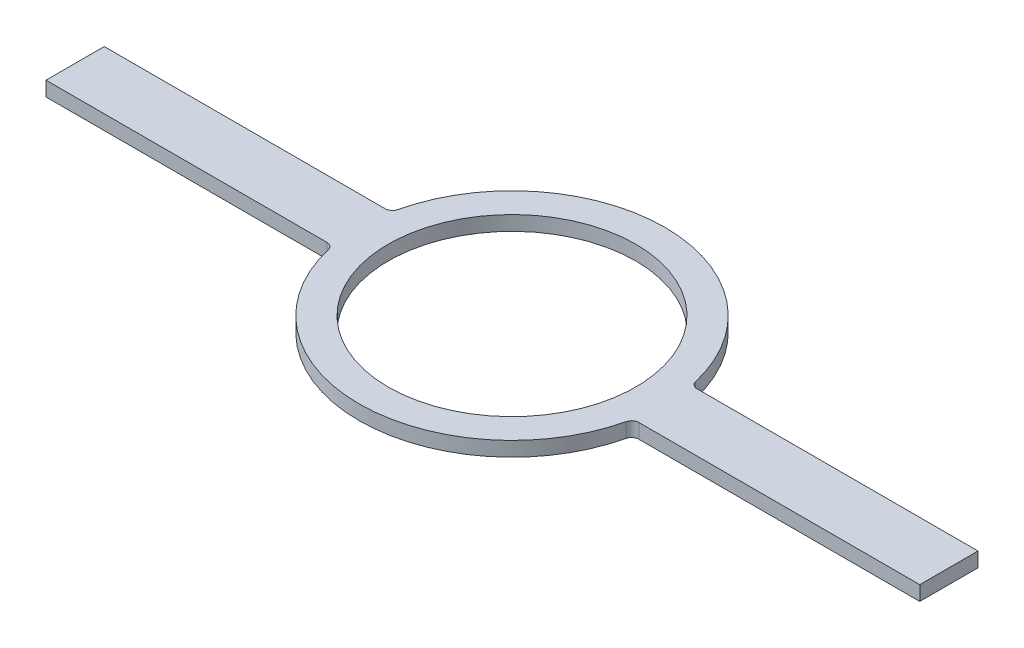
from build123d import *

# Parameters (mm, degrees)
SKETCH1_R           = 53.975
BOSS_EXTRUDE1_DEPTH = 6.35
FILLET1_R           = 3.175


with BuildPart() as part:
    # Sketch1 → Boss-Extrude1 (new body)
    with BuildSketch(Plane(origin=(0, 0, 0), x_dir=(1, 0, 0), z_dir=(0, 1, 0))):
        with BuildLine():
            Line((65.454301807, 12.7), (190.5, 12.7))
            Line((190.5, 12.7), (190.5, -12.7))
            Line((190.5, -12.7), (65.454301807, -12.7))
            ThreePointArc((65.454301807, -12.7), (0, -66.675), (-65.454301807, -12.7))
            Line((-65.454301807, -12.7), (-190.5, -12.7))
            Line((-190.5, -12.7), (-190.5, 12.7))
            Line((-190.5, 12.7), (-65.454301807, 12.7))
            ThreePointArc((-65.454301807, 12.7), (0, 66.675), (65.454301807, 12.7))
        make_face()
        with Locations(Location((0, 0, 0), (0, 0, 270))):
            Circle(SKETCH1_R, mode=Mode.SUBTRACT)
    extrude(amount=BOSS_EXTRUDE1_DEPTH)

    # Fillet1
    fillet1_edges = [part.edges().sort_by_distance(p)[0] for p in [
        (65.454301807, 3.175, 12.7),
        (-65.454301807, 3.175, 12.7),
        (-65.454301807, 3.175, -12.7),
        (65.454301807, 3.175, -12.7),
    ]]
    fillet(fillet1_edges, radius=FILLET1_R)


solid = part.part
